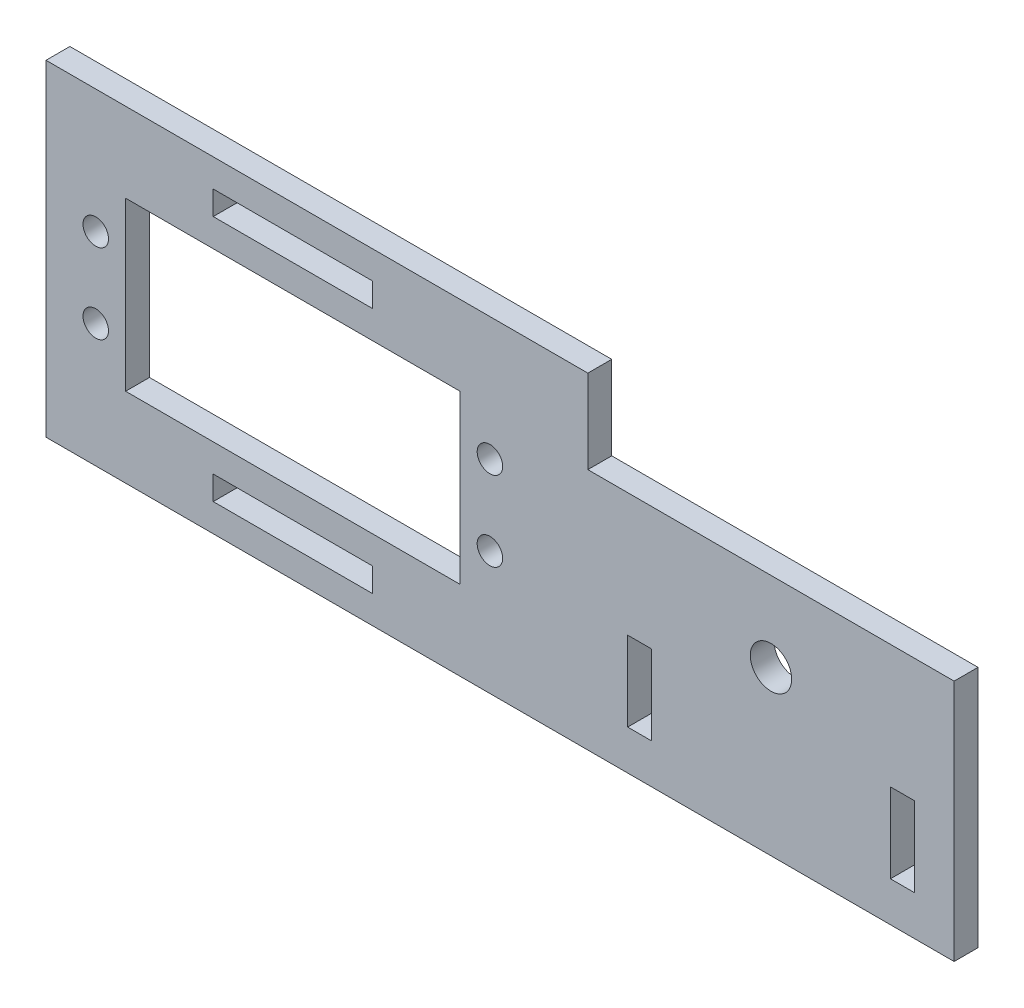
from build123d import *

# Parameters (mm, degrees)
ESBO_O1_W                = 20
ESBO_O1_H                = 3
ESBO_O1_R                = 1.6
ESBO_O1_W_2              = 42
ESBO_O1_H_2              = 21
ESBO_O1_W_3              = 3
ESBO_O1_H_3              = 10
ESBO_O1_R_2              = 2.6
RESSALTO_EXTRUS_O1_DEPTH = 3


with BuildPart() as part:
    # Esboço1 → Ressalto-extrusão1 (new body)
    with BuildSketch(Plane.XY):
        Polygon((-23, 0), (23, 0), (23, 30.5), (-23, 30.5), (-23, 41), (-91.05, 41), (-91.05, 0), align=None)
        with Locations((-60.05, 5)):
            Rectangle(ESBO_O1_W, ESBO_O1_H, mode=Mode.SUBTRACT)
        with Locations((-84.8, 15.5)):
            Circle(ESBO_O1_R, mode=Mode.SUBTRACT)
        with Locations((-60.05, 20.5)):
            Rectangle(ESBO_O1_W_2, ESBO_O1_H_2, mode=Mode.SUBTRACT)
        with Locations((-35.3, 15.5)):
            Circle(ESBO_O1_R, mode=Mode.SUBTRACT)
        with Locations((-16.5, 10)):
            Rectangle(ESBO_O1_W_3, ESBO_O1_H_3, mode=Mode.SUBTRACT)
        with Locations((16.5, 10)):
            Rectangle(ESBO_O1_W_3, ESBO_O1_H_3, mode=Mode.SUBTRACT)
        with Locations((0, 20.5)):
            Circle(ESBO_O1_R_2, mode=Mode.SUBTRACT)
        with Locations((-84.8, 25.5)):
            Circle(ESBO_O1_R, mode=Mode.SUBTRACT)
        with Locations((-35.3, 25.5)):
            Circle(ESBO_O1_R, mode=Mode.SUBTRACT)
        with Locations((-60.05, 36)):
            Rectangle(ESBO_O1_W, ESBO_O1_H, mode=Mode.SUBTRACT)
    extrude(amount=RESSALTO_EXTRUS_O1_DEPTH)


solid = part.part
